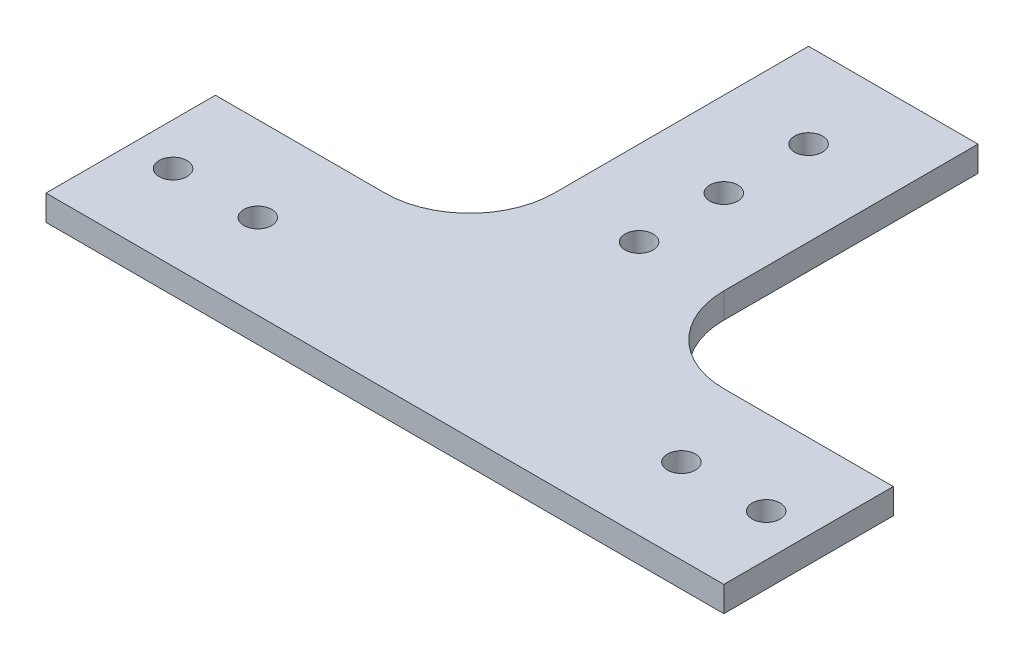
from build123d import *

# Parameters (mm, degrees)
SKETCH_1_R      = 1.65
EXTRUDE_1_DEPTH = 3
FILLET_1_R      = 10


with BuildPart() as part:
    # 草图1 → 凸台-拉伸1 (new body)
    with BuildSketch(Plane(origin=(0, 0, 0), x_dir=(1, 0, 0), z_dir=(0, 1, 0))):
        Polygon((-40.334108275, -30.334108275), (39.665891725, -30.334108275), (39.665891725, -10.334108275), (9.665891725, -10.334108275), (9.665891725, 29.665891725), (-10.334108275, 29.665891725), (-10.334108275, -10.334108275), (-40.334108275, -10.334108275), align=None)
        with Locations(Location((-0.334108275, -0.334108275, 0), (0, 0, 270))):
            Circle(SKETCH_1_R, mode=Mode.SUBTRACT)
        with Locations(Location((-0.334108275, 9.665891725, 0), (0, 0, 270))):
            Circle(SKETCH_1_R, mode=Mode.SUBTRACT)
        with Locations(Location((-0.334108275, 19.665891725, 0), (0, 0, 270))):
            Circle(SKETCH_1_R, mode=Mode.SUBTRACT)
        with Locations(Location((-25.334108275, -20.334108275, 0), (0, 0, 270))):
            Circle(SKETCH_1_R, mode=Mode.SUBTRACT)
        with Locations(Location((-35.334108275, -20.334108275, 0), (0, 0, 270))):
            Circle(SKETCH_1_R, mode=Mode.SUBTRACT)
        with Locations(Location((24.665891725, -20.334108275, 0), (0, 0, 270))):
            Circle(SKETCH_1_R, mode=Mode.SUBTRACT)
        with Locations(Location((34.665891725, -20.334108275, 0), (0, 0, 270))):
            Circle(SKETCH_1_R, mode=Mode.SUBTRACT)
    extrude(amount=EXTRUDE_1_DEPTH)

    # 圆角1
    fillet_1_edges = [part.edges().sort_by_distance(p)[0] for p in [
        (-10.334108275, 1.5, 10.334108275),
        (9.665891725, 1.5, 10.334108275),
    ]]
    fillet(fillet_1_edges, radius=FILLET_1_R)


solid = part.part
